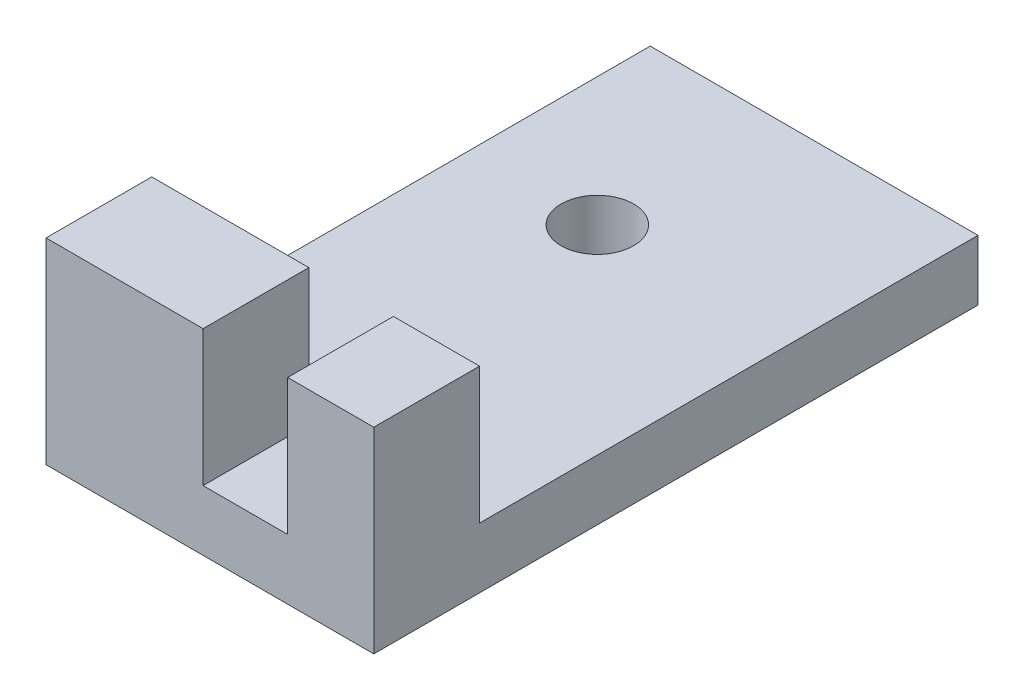
from build123d import *

# Parameters (mm, degrees)
SKETCH1_W           = 21.7
SKETCH1_H           = 40
BOSS_EXTRUDE1_DEPTH = 13
SKETCH3_W           = 21.7
SKETCH3_H           = 33
CUT_EXTRUDE1_DEPTH  = 9
SKETCH5_W           = 5.6
SKETCH5_H           = 9
CUT_EXTRUDE2_DEPTH  = 42.57992304
SKETCH6_R           = 2.4
CUT_EXTRUDE4_DEPTH  = 47.388468395


with BuildPart() as part:
    # Sketch1 → Boss-Extrude1 (new body)
    with BuildSketch(Plane(origin=(0, 0, 0), x_dir=(1, 0, 0), z_dir=(0, 1, 0))):
        with Locations((10.85, -20)):
            Rectangle(SKETCH1_W, SKETCH1_H)
    extrude(amount=BOSS_EXTRUDE1_DEPTH)

    # Sketch3 → Cut-Extrude1 (cut)
    with BuildSketch(Plane(origin=(0, 13, 0), x_dir=(1, 0, 0), z_dir=(0, 1, 0))):
        with Locations((10.85, -16.5)):
            Rectangle(SKETCH3_W, SKETCH3_H)
    extrude(amount=-CUT_EXTRUDE1_DEPTH, mode=Mode.SUBTRACT)

    # Sketch5 → Cut-Extrude2 (cut, through all)
    with BuildSketch(Plane(origin=(0, 0, 33), x_dir=(-1, 0, 0), z_dir=(0, 0, -1))):
        with Locations((-13.2, 8.5)):
            Rectangle(SKETCH5_W, SKETCH5_H)
    extrude(amount=-CUT_EXTRUDE2_DEPTH, mode=Mode.SUBTRACT)

    # Sketch6 → Cut-Extrude4 (cut, through all)
    with BuildSketch(Plane(origin=(0, 4, 0), x_dir=(1, 0, 0), z_dir=(0, 1, 0))):
        with Locations(Location((8.5, -12, 0), (0, 0, 270))):
            Circle(SKETCH6_R)
    extrude(amount=-CUT_EXTRUDE4_DEPTH, mode=Mode.SUBTRACT)


solid = part.part
